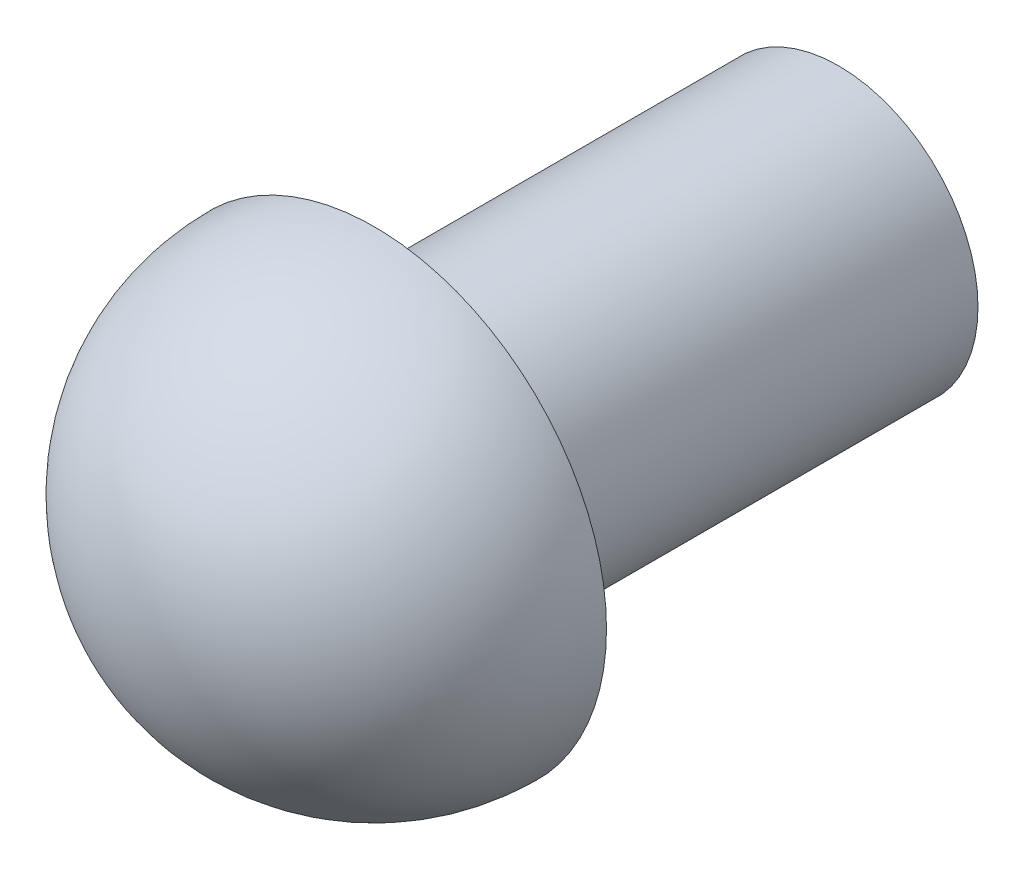
from build123d import *

# Parameters (mm, degrees)
REVOLVE1_ANGLE      = 180
SKETCH5_R           = 3
BOSS_EXTRUDE1_DEPTH = 10


with BuildPart() as part:
    # Sketch2 → Revolve1 (revolve)
    with BuildSketch(Plane.XY):
        with BuildLine():
            Line((0, 0), (0, 10))
            ThreePointArc((0, 10), (-5, 5), (0, 0))
        make_face()
    revolve(axis=Axis((0, 0, 0), (0, 1, 0)), revolution_arc=REVOLVE1_ANGLE)

    # Sketch5 → Boss-Extrude1 (add)
    with BuildSketch(Plane(origin=(0, 0, 0), x_dir=(-1, 0, 0), z_dir=(0, 0, -1))):
        with Locations((0, 5)):
            Circle(SKETCH5_R)
    extrude(amount=BOSS_EXTRUDE1_DEPTH)


solid = part.part
